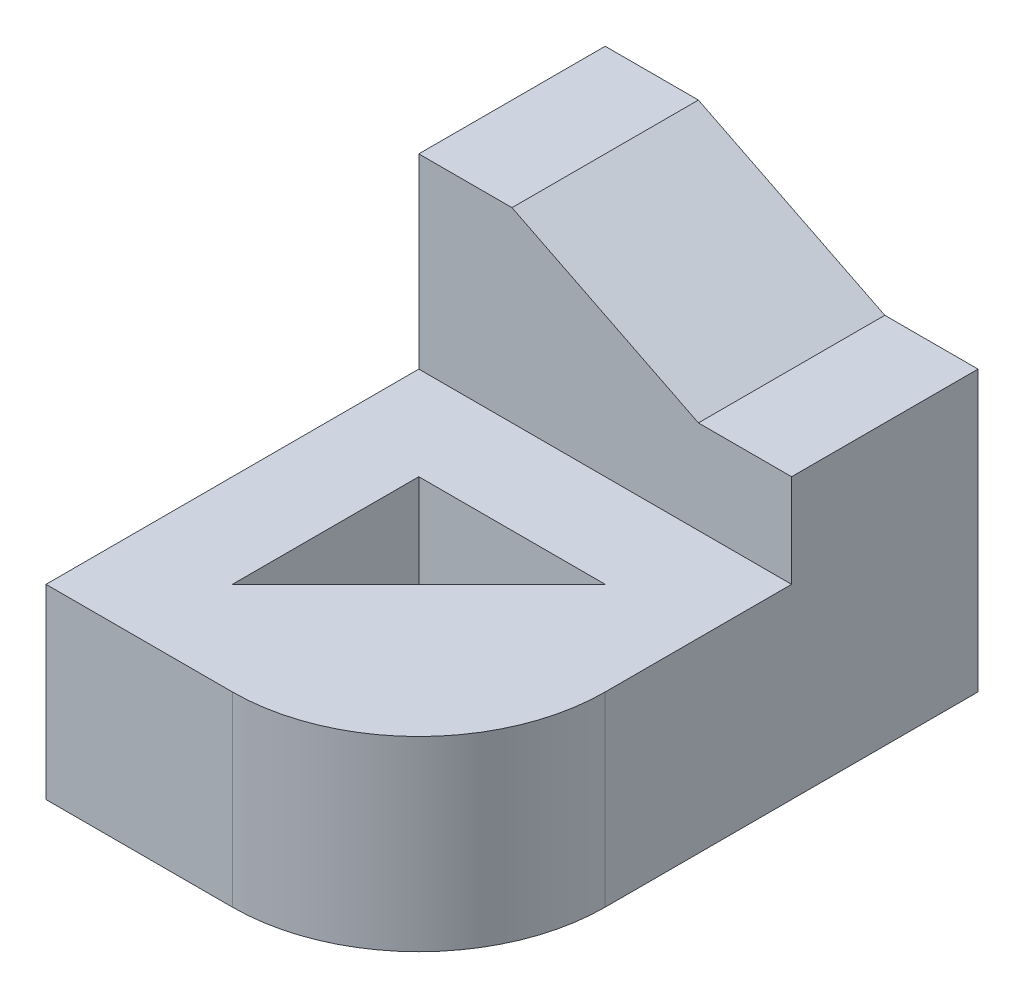
from build123d import *

# Parameters (mm, degrees)
BOSS_EXTRUDE1_DEPTH = 20
BOSS_EXTRUDE2_DEPTH = 20


with BuildPart() as part:
    # Sketch1 → Boss-Extrude1 (new body)
    with BuildSketch(Plane(origin=(0, 0, 0), x_dir=(1, 0, 0), z_dir=(0, 1, 0))):
        with BuildLine():
            Line((-20, 30), (20, 30))
            Line((20, 30), (20, -10))
            ThreePointArc((20, -10), (14.142135624, -24.142135624), (0, -30))
            Line((0, -30), (-20, -30))
            Line((-20, -30), (-20, 30))
        make_face()
        Polygon((-10, 0), (-10, -20), (10, 0), align=None, mode=Mode.SUBTRACT)
    extrude(amount=BOSS_EXTRUDE1_DEPTH)

    # Sketch2 → Boss-Extrude2 (add)
    with BuildSketch(Plane(origin=(0, 0, -30), x_dir=(-1, 0, 0), z_dir=(0, 0, -1))):
        Polygon((20, 20), (20, 40), (10, 40), (-10, 30), (-20, 30), (-20, 20), align=None)
    extrude(amount=-BOSS_EXTRUDE2_DEPTH)


solid = part.part
